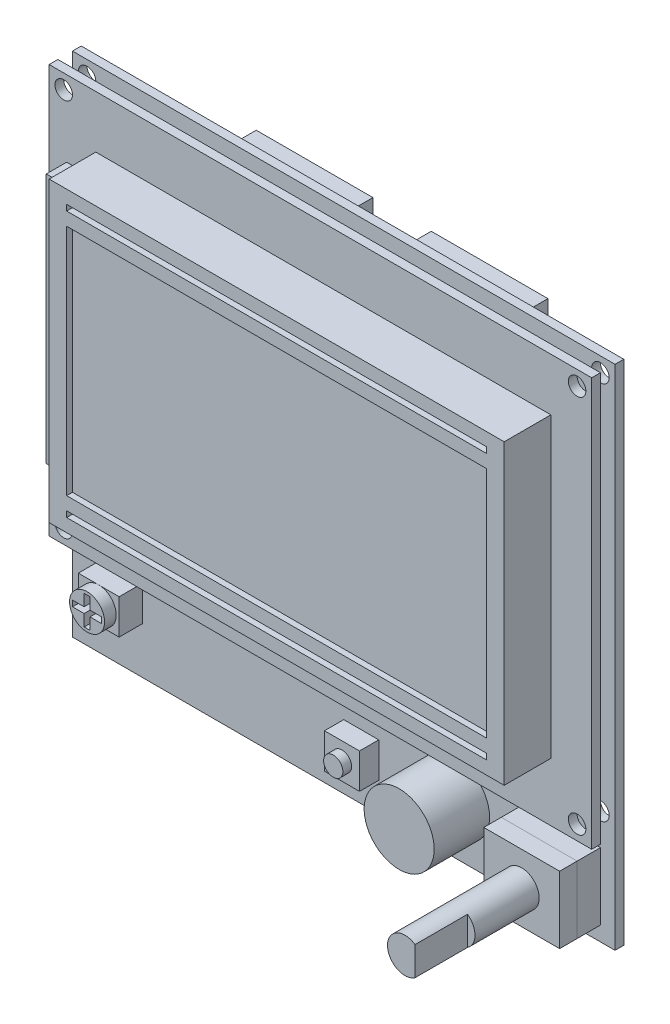
from build123d import *

# Parameters (mm, degrees)
ESQUISSE1_W             = 78
ESQUISSE1_H             = 51
BOSS_EXTRU_1_DEPTH      = 8
ESQUISSE2_W             = 72
ESQUISSE2_H             = 40
ESQUISSE2_H_2           = 1
ENL_V_MAT_EXTRU_1_DEPTH = 1
ESQUISSE3_W             = 5
ESQUISSE3_H             = 43
BOSS_EXTRU_2_DEPTH      = 3.5
ESQUISSE4_W             = 93
ESQUISSE4_H             = 70
ESQUISSE4_R             = 1.5
BOSS_EXTRU_3_DEPTH      = 1.5
ESQUISSE5_W             = 93
ESQUISSE5_H             = 87
ESQUISSE5_R             = 1.5
BOSS_EXTRU_4_DEPTH      = 1.5
BOSS_EXTRU_5_DEPTH      = 25
ESQUISSE7_W             = 20
ESQUISSE7_H             = 9
ESQUISSE7_W_2           = 18
ESQUISSE7_H_2           = 7
BOSS_EXTRU_6_DEPTH      = 9
BOSS_EXTRU_6_2_DEPTH    = 9
ESQUISSE8_W             = 13
ESQUISSE8_H             = 11.5
BOSS_EXTRU_7_DEPTH      = 4
ESQUISSE8_W_2           = 7
ESQUISSE8_H_2           = 6
BOSS_EXTRU_7_2_DEPTH    = 4
ESQUISSE9_W             = 13
ESQUISSE9_H             = 11.5
BOSS_EXTRU_8_DEPTH      = 3
ESQUISSE10_R            = 3
BOSS_EXTRU_9_DEPTH      = 20
ESQUISSE11_W            = 20.196518619
ESQUISSE11_H            = 4.923957274
ENL_V_MAT_EXTRU_2_DEPTH = 9
ESQUISSE12_R            = 6
BOSS_EXTRU_10_DEPTH     = 9.5
ESQUISSE13_R            = 3
BOSS_EXTRU_11_DEPTH     = 2
ESQUISSE14_W            = 6
ESQUISSE14_H            = 6
BOSS_EXTRU_12_DEPTH     = 3.3
ESQUISSE15_R            = 1.65
BOSS_EXTRU_13_DEPTH     = 1.5


with BuildPart() as part:
    # Esquisse1 → Boss.-Extru.1 (new body)
    with BuildSketch(Plane.XY):
        with Locations((0, 25.5)):
            Rectangle(ESQUISSE1_W, ESQUISSE1_H)
    extrude(amount=BOSS_EXTRU_1_DEPTH)

    # Esquisse2 → Enlèv. mat.-Extru.1 (cut)
    with BuildSketch(Plane.XY.offset(8)):
        with Locations((0, 25.5)):
            Rectangle(ESQUISSE2_W, ESQUISSE2_H)
        with Locations((0, 2.75)):
            Rectangle(ESQUISSE2_W, ESQUISSE2_H_2)
        with Locations((0, 48.25)):
            Rectangle(ESQUISSE2_W, ESQUISSE2_H_2)
    extrude(amount=-ENL_V_MAT_EXTRU_1_DEPTH, mode=Mode.SUBTRACT)


with BuildPart() as body_2:
    # Esquisse3 → Boss.-Extru.2 (new body)
    with BuildSketch(Plane(origin=(0, 0, 0), x_dir=(-1, 0, 0), z_dir=(0, 0, -1))):
        with Locations((41.5, 25.5)):
            Rectangle(ESQUISSE3_W, ESQUISSE3_H)
    extrude(amount=-BOSS_EXTRU_2_DEPTH)


with BuildPart() as body_3:
    # Esquisse4 → Boss.-Extru.3 (new body)
    with BuildSketch(Plane(origin=(0, 0, 0), x_dir=(-1, 0, 0), z_dir=(0, 0, -1))):
        with Locations((0.5, 25)):
            Rectangle(ESQUISSE4_W, ESQUISSE4_H)
        with Locations((-43.5, 57.5)):
            Circle(ESQUISSE4_R, mode=Mode.SUBTRACT)
        with Locations(Location((-43.5, -7.5, 0), (0, 0, 180))):
            Circle(ESQUISSE4_R, mode=Mode.SUBTRACT)
        with Locations(Location((44.5, 57.5, 0), (0, 0, 180))):
            Circle(ESQUISSE4_R, mode=Mode.SUBTRACT)
        with Locations((44.5, -7.5)):
            Circle(ESQUISSE4_R, mode=Mode.SUBTRACT)
    extrude(amount=BOSS_EXTRU_3_DEPTH)


with BuildPart() as body_4:
    # Esquisse5 → Boss.-Extru.4 (new body)
    with BuildSketch(Plane(origin=(0, 0, -4), x_dir=(-1, 0, 0), z_dir=(0, 0, -1))):
        with Locations((0.5, 16.5)):
            Rectangle(ESQUISSE5_W, ESQUISSE5_H)
        with Locations((-43.5, 57.5)):
            Circle(ESQUISSE5_R, mode=Mode.SUBTRACT)
        with Locations((-43.5, -7.5)):
            Circle(ESQUISSE5_R, mode=Mode.SUBTRACT)
        with Locations((44.5, -7.5)):
            Circle(ESQUISSE5_R, mode=Mode.SUBTRACT)
        with Locations((44.5, 57.5)):
            Circle(ESQUISSE5_R, mode=Mode.SUBTRACT)
    extrude(amount=BOSS_EXTRU_4_DEPTH)


with BuildPart() as body_5:
    # Esquisse6 → Boss.-Extru.5 (new body)
    with BuildSketch(Plane.ZY.offset(47)):
        Polygon((-5.5, 38.5), (-8.5, 38.5), (-8.5, 12), (-5.5, 12), (-5.5, 12.25), (-8.25, 12.25), (-8.25, 38.25), (-5.5, 38.25), align=None)
    extrude(amount=-BOSS_EXTRU_5_DEPTH)


with BuildPart() as body_6:
    # Esquisse7 → Boss.-Extru.6 (new body)
    with BuildSketch(Plane(origin=(0, 0, -5.5), x_dir=(-1, 0, 0), z_dir=(0, 0, -1))):
        with Locations((16, 49)):
            Rectangle(ESQUISSE7_W, ESQUISSE7_H)
        with Locations((16, 49)):
            Rectangle(ESQUISSE7_W_2, ESQUISSE7_H_2, mode=Mode.SUBTRACT)
    extrude(amount=BOSS_EXTRU_6_DEPTH)


with BuildPart() as body_7:
    # Esquisse7 → Boss.-Extru.6 2 (new body)
    with BuildSketch(Plane(origin=(0, 0, -5.5), x_dir=(-1, 0, 0), z_dir=(0, 0, -1))):
        with Locations((-14, 49)):
            Rectangle(ESQUISSE7_W, ESQUISSE7_H)
        with Locations((-14, 49)):
            Rectangle(ESQUISSE7_W_2, ESQUISSE7_H_2, mode=Mode.SUBTRACT)
    extrude(amount=BOSS_EXTRU_6_2_DEPTH)


with BuildPart() as body_8:
    # Esquisse8 → Boss.-Extru.7 (new body)
    with BuildSketch(Plane.XY.offset(-4)):
        with Locations((37, -18.75)):
            Rectangle(ESQUISSE8_W, ESQUISSE8_H)
    extrude(amount=BOSS_EXTRU_7_DEPTH)


with BuildPart() as body_9:
    # Esquisse8 → Boss.-Extru.7 2 (new body)
    with BuildSketch(Plane.XY.offset(-4)):
        with Locations((-38.5, -16)):
            Rectangle(ESQUISSE8_W_2, ESQUISSE8_H_2)
    extrude(amount=BOSS_EXTRU_7_2_DEPTH)


with BuildPart() as body_10:
    # Esquisse9 → Boss.-Extru.8 (new body)
    with BuildSketch(Plane.XY):
        with Locations((37, -18.75)):
            Rectangle(ESQUISSE9_W, ESQUISSE9_H)
    extrude(amount=BOSS_EXTRU_8_DEPTH)


with BuildPart() as body_11:
    # Esquisse10 → Boss.-Extru.9 (new body)
    with BuildSketch(Plane.XY.offset(3)):
        with Locations((37, -18.75)):
            Circle(ESQUISSE10_R)
    extrude(amount=BOSS_EXTRU_9_DEPTH)

    # Esquisse11 → Enlèv. mat.-Extru.2 (cut)
    with BuildSketch(Plane.XY.offset(23)):
        with Locations((48.812511681, -18.75)):
            Rectangle(ESQUISSE11_W, ESQUISSE11_H)
    extrude(amount=-ENL_V_MAT_EXTRU_2_DEPTH, mode=Mode.SUBTRACT)


with BuildPart() as body_12:
    # Esquisse12 → Boss.-Extru.10 (new body)
    with BuildSketch(Plane.XY.offset(-4)):
        with Locations((18.5, -18)):
            Circle(ESQUISSE12_R)
    extrude(amount=BOSS_EXTRU_10_DEPTH)


with BuildPart() as body_13:
    # Esquisse13 → Boss.-Extru.11 (new body)
    with BuildSketch(Plane.XY):
        with Locations((-38.5, -16)):
            Circle(ESQUISSE13_R)
        Polygon((-38, -13.5), (-39, -13.5), (-39, -15.5), (-41, -15.5), (-41, -16.5), (-39, -16.5), (-39, -18.5), (-38, -18.5), (-38, -16.5), (-36, -16.5), (-36, -15.5), (-38, -15.5), align=None, mode=Mode.SUBTRACT)
    extrude(amount=BOSS_EXTRU_11_DEPTH)


with BuildPart() as body_14:
    # Esquisse14 → Boss.-Extru.12 (new body)
    with BuildSketch(Plane.XY.offset(-4)):
        with Locations((2.5, -19)):
            Rectangle(ESQUISSE14_W, ESQUISSE14_H)
    extrude(amount=BOSS_EXTRU_12_DEPTH)


with BuildPart() as body_15:
    # Esquisse15 → Boss.-Extru.13 (new body)
    with BuildSketch(Plane.XY.offset(-0.7)):
        with Locations((2.5, -19)):
            Circle(ESQUISSE15_R)
    extrude(amount=BOSS_EXTRU_13_DEPTH)


solid = Compound([part.part, body_2.part, body_3.part, body_4.part, body_5.part, body_6.part, body_7.part, body_8.part, body_9.part, body_10.part, body_11.part, body_12.part, body_13.part, body_14.part, body_15.part])
